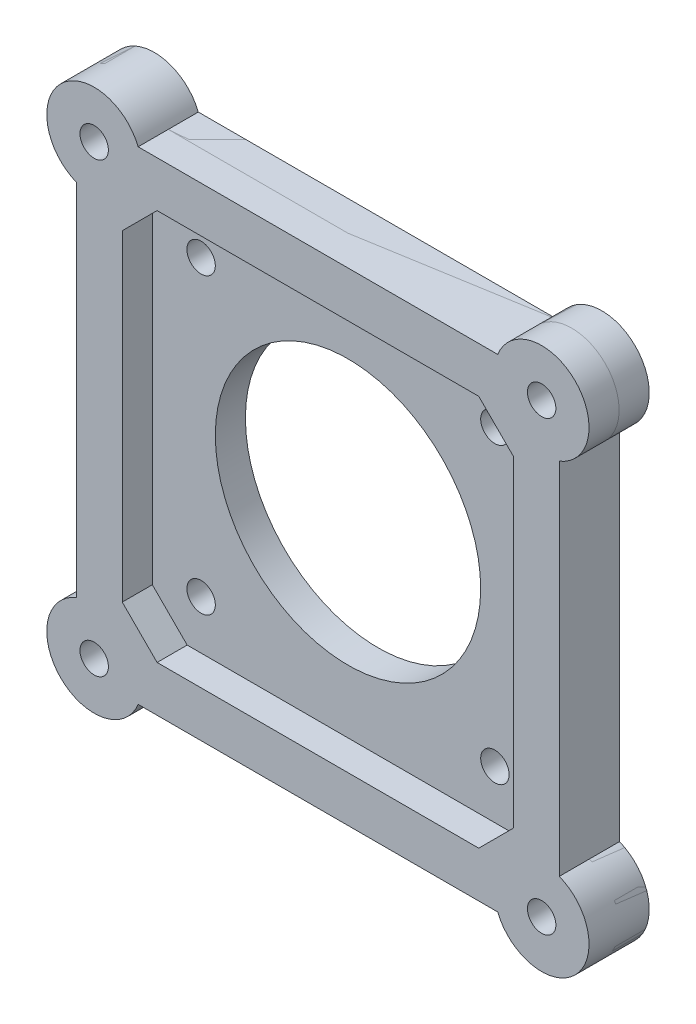
from build123d import *

# Parameters (mm, degrees)
BOSS_EXTRU_2_DEPTH        = 6.35
ESQUISSE29_R              = 5
BOSS_EXTRU_3_DEPTH        = 6.35
SYM_TRIE2_COPY_1_SKETCH_R = 5
SYM_TRIE2_COPY_1_DEPTH    = 6.35
ESQUISSE30_R              = 1.5
ENL_V_MAT_EXTRU_1_DEPTH   = 41.953581056
ESQUISSE31_R              = 1.5
BOSS_EXTRU_4_DEPTH        = 3.175
ESQUISSE32_R              = 1.5
ESQUISSE32_R_2            = 14
ENL_V_MAT_EXTRU_2_DEPTH   = 41.582680127


with BuildPart() as part:
    # Esquisse28 → Boss.-Extru.2 (new body)
    with BuildSketch(Plane.XY):
        Polygon((-18.97, -25.475382387), (-25.475382387, -18.97), (-25.475382387, 18.97), (-18.97, 25.475382387), (18.97, 25.475382387), (25.475382387, 18.97), (25.475382387, -18.97), (18.97, -25.475382387), align=None)
        Polygon((-16.97, -20.645541049), (-20.645541049, -16.97), (-20.645541049, 16.97), (-16.97, 20.645541049), (16.97, 20.645541049), (20.645541049, 16.97), (20.645541049, -16.97), (16.97, -20.645541049), align=None, mode=Mode.SUBTRACT)
    extrude(amount=BOSS_EXTRU_2_DEPTH)

    # Esquisse29 → Boss.-Extru.3 (add)
    with BuildSketch(Plane.XY):
        with Locations((23.60833184, 23.60833184)):
            Circle(ESQUISSE29_R)
    boss_extru_3 = extrude(amount=BOSS_EXTRU_3_DEPTH)

    # Symétrie1: Boss.-Extru.3 across plane
    add(boss_extru_3.mirror(Plane(origin=(0, 0, 0), x_dir=(0, 0, 1), z_dir=(1, 0, 0))))

    # Symétrie2: Boss.-Extru.3 across plane
    add(boss_extru_3.mirror(Plane.ZX))

    # Symétrie2 copy 1 sketch → Symétrie2 copy 1 (add)
    with BuildSketch(Plane(origin=(0, 0, 0), x_dir=(-1, 0, 0), z_dir=(0, 0, 1))):
        with Locations((23.60833184, 23.60833184)):
            Circle(SYM_TRIE2_COPY_1_SKETCH_R)
    extrude(amount=SYM_TRIE2_COPY_1_DEPTH)

    # Esquisse30 → Enlèv. mat.-Extru.1 (cut, through all)
    with BuildSketch(Plane.XY.offset(6.35)):
        with Locations((-23.60833184, 23.60833184)):
            Circle(ESQUISSE30_R)
        with Locations((23.60833184, 23.60833184)):
            Circle(ESQUISSE30_R)
        with Locations((23.60833184, -23.60833184)):
            Circle(ESQUISSE30_R)
        with Locations((-23.60833184, -23.60833184)):
            Circle(ESQUISSE30_R)
    extrude(amount=-ENL_V_MAT_EXTRU_1_DEPTH, mode=Mode.SUBTRACT)


with BuildPart() as body_2:
    # Esquisse31 → Boss.-Extru.4 (new body)
    with BuildSketch(Plane.XY):
        with BuildLine():
            Line((-18.97, -25.475382387), (18.97, -25.475382387))
            ThreePointArc((18.97, -25.475382387), (27.143865745, -27.143865745), (25.475382387, -18.97))
            Line((25.475382387, -18.97), (25.475382387, 18.97))
            ThreePointArc((25.475382387, 18.97), (27.143865745, 27.143865745), (18.97, 25.475382387))
            Line((18.97, 25.475382387), (-18.97, 25.475382387))
            ThreePointArc((-18.97, 25.475382387), (-27.143865745, 27.143865745), (-25.475382387, 18.97))
            Line((-25.475382387, 18.97), (-25.475382387, -18.97))
            ThreePointArc((-25.475382387, -18.97), (-27.143865745, -27.143865745), (-18.97, -25.475382387))
        make_face()
        with Locations((23.60833184, 23.60833184)):
            Circle(ESQUISSE31_R, mode=Mode.SUBTRACT)
        with Locations((-23.60833184, 23.60833184)):
            Circle(ESQUISSE31_R, mode=Mode.SUBTRACT)
        with Locations((-23.60833184, -23.60833184)):
            Circle(ESQUISSE31_R, mode=Mode.SUBTRACT)
        with Locations((23.60833184, -23.60833184)):
            Circle(ESQUISSE31_R, mode=Mode.SUBTRACT)
    extrude(amount=BOSS_EXTRU_4_DEPTH)

    # Esquisse32 → Enlèv. mat.-Extru.2 (cut, through all)
    with BuildSketch(Plane.XY.offset(3.175)):
        with Locations((-15.5, -15.5)):
            Circle(ESQUISSE32_R)
        with Locations((15.5, -15.5)):
            Circle(ESQUISSE32_R)
        with Locations((15.5, 15.5)):
            Circle(ESQUISSE32_R)
        with Locations((-15.5, 15.5)):
            Circle(ESQUISSE32_R)
        Circle(ESQUISSE32_R_2)
    extrude(amount=-ENL_V_MAT_EXTRU_2_DEPTH, mode=Mode.SUBTRACT)


solid = Compound([part.part, body_2.part])
